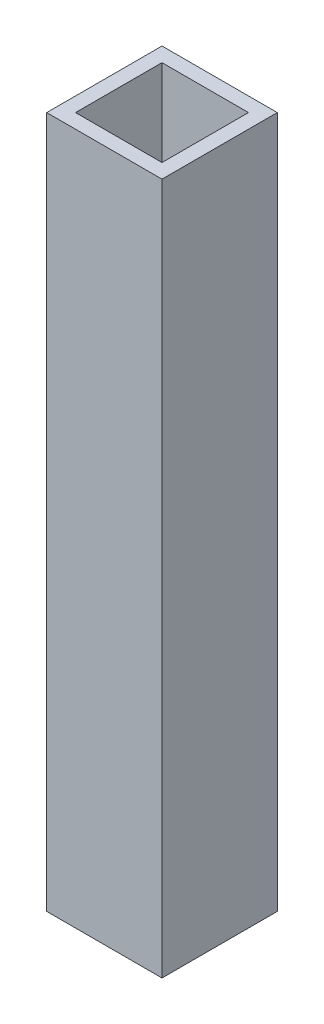
from build123d import *

# Parameters (mm, degrees)
SKETCH1_W           = 25.4
SKETCH1_H           = 25.4
SKETCH1_W_2         = 19.05
SKETCH1_H_2         = 19.05
BOSS_EXTRUDE1_DEPTH = 152.4


with BuildPart() as part:
    # Sketch1 → Boss-Extrude1 (new body)
    with BuildSketch(Plane(origin=(0, 0, 0), x_dir=(1, 0, 0), z_dir=(0, 1, 0))):
        with Locations((12.7, 12.7)):
            Rectangle(SKETCH1_W, SKETCH1_H)
        with Locations((12.7, 12.7)):
            Rectangle(SKETCH1_W_2, SKETCH1_H_2, mode=Mode.SUBTRACT)
    extrude(amount=BOSS_EXTRUDE1_DEPTH)


solid = part.part
